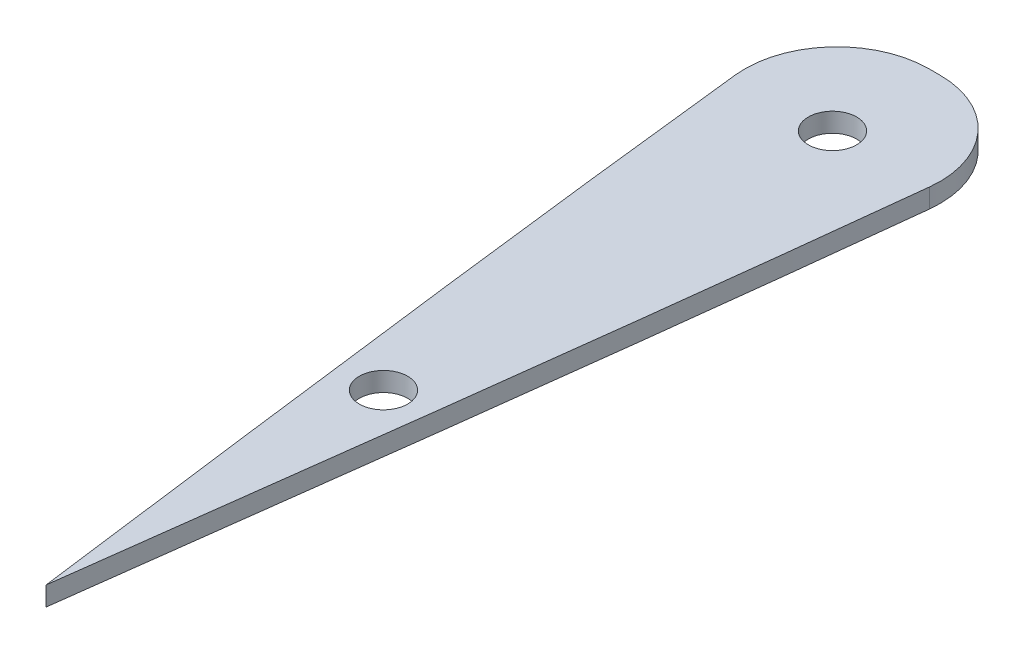
from build123d import *

# Parameters (mm, degrees)
SKETCH1_R               = 1.984375
BOSS_EXTRUDE1_DEPTH     = 169.87266
SKETCH2_W               = 35.763807095
SKETCH2_H               = 22.705005105
CUT_EXTRUDE1_DEPTH      = 23.05812
CUT_EXTRUDE2_START      = -169.87266
SKETCH2_2_W             = 35.763807095
SKETCH2_2_H             = 22.705005105
CUT_EXTRUDE2_DEPTH      = 23.05812
FILLET1_R               = 7.62
CUT_EXTRUDE3_DEPTH      = 198.390942599
CUT_EXTRUDE3_DEPTH_BACK = 198.390942599
SKETCH6_R               = 2
CUT_EXTRUDE4_DEPTH      = 198.390942599
CUT_EXTRUDE4_DEPTH_BACK = 198.390942599
SKETCH7_W               = 96.266326783
SKETCH7_H               = 159.284833333
SKETCH7_H_2             = 9.000326667


with BuildPart() as part:
    # Sketch1 → Boss-Extrude1 (new body)
    with BuildSketch(Plane(origin=(0, 0, 0), x_dir=(1, 0, 0), z_dir=(0, 1, 0))):
        with BuildLine():
            Line((-9.955287346, -3.607451573), (-6.769721368, -3.607451573))
            Line((-6.769721368, -3.607451573), (8.985913589, -3.607451573))
            Line((8.985913589, -3.607451573), (12.171479568, -3.607451573))
            add(Edge.make_bspline(
                [(10.60289965, -20.752451573), (11.099968974, -15.730201571), (11.630563617, -10.016003166), (12.113997871, -4.296816952), (12.171479568, -3.607451573)],
                knots=[0.384969626, 0.384969626, 0.384969626, 0.384969626, 0.458108671, 0.468131593, 0.468131593, 0.468131593, 0.468131593], degree=3))
            add(Edge.make_bspline(
                [(1.108096111, -99.873778356), (4.527344744, -73.531764163), (7.9865599, -47.187219652), (10.60289965, -20.752451573)],
                knots=[0, 0, 0, 0, 0.384969626, 0.384969626, 0.384969626, 0.384969626], degree=3))
            add(Edge.make_bspline(
                [(1.108096111, -99.873778356), (-2.311152522, -73.531764163), (-5.770367679, -47.187219652), (-8.386707429, -20.752451573)],
                knots=[0, 0, 0, 0, 0.384969626, 0.384969626, 0.384969626, 0.384969626], degree=3))
            add(Edge.make_bspline(
                [(-8.386707429, -20.752451573), (-8.883776753, -15.730201571), (-9.414371396, -10.016003166), (-9.89780565, -4.296816952), (-9.955287346, -3.607451573)],
                knots=[0.384969626, 0.384969626, 0.384969626, 0.384969626, 0.458108671, 0.468131593, 0.468131593, 0.468131593, 0.468131593], degree=3))
        make_face()
        with Locations(Location((1.108108569, -11.326456678, 0), (0, 0, 270))):
            Circle(SKETCH1_R, mode=Mode.SUBTRACT)
    extrude(amount=BOSS_EXTRUDE1_DEPTH)

    # Sketch2 → Cut-Extrude1 (cut)
    with BuildSketch(Plane(origin=(0, 169.87266, 0), x_dir=(1, 0, 0), z_dir=(0, 1, 0))):
        with Locations((7.926616202, -14.959954125)):
            Rectangle(SKETCH2_W, SKETCH2_H)
    extrude(amount=-CUT_EXTRUDE1_DEPTH, mode=Mode.SUBTRACT)

    # Sketch2<2> → Cut-Extrude2 (cut)
    with BuildSketch(Plane(origin=(0, 169.87266, 0), x_dir=(1, 0, 0), z_dir=(0, 1, 0)).offset(CUT_EXTRUDE2_START)):
        with Locations((7.926616202, -14.959954125)):
            Rectangle(SKETCH2_2_W, SKETCH2_2_H)
    extrude(amount=CUT_EXTRUDE2_DEPTH, mode=Mode.SUBTRACT)

    # Fillet1
    fillet1_edges = [part.edges().sort_by_distance(p)[0] for p in [
        (-7.824155374, 11.52906, 26.312456678),
        (10.040347595, 11.52906, 26.312456678),
        (-9.955287346, 84.93633, 3.607451573),
        (12.171479568, 84.93633, 3.607451573),
        (-7.824155374, 158.3436, 26.312456678),
        (10.040347595, 158.3436, 26.312456678),
    ]]
    fillet(fillet1_edges, radius=FILLET1_R)

    # Sketch6 → Cut-Extrude3 (cut, two sides: drawn at the far end of the back side and taken through both)
    with BuildSketch(Plane.XZ.offset(-CUT_EXTRUDE3_DEPTH_BACK)):
        with Locations(Location((1.108096111, 71.933778356, 0), (0, 0, 270))):
            Circle(SKETCH6_R)
        with Locations(Location((1.108096111, 34.760552137, 0), (0, 0, 270))):
            Circle(SKETCH6_R)
    extrude(amount=CUT_EXTRUDE3_DEPTH + CUT_EXTRUDE3_DEPTH_BACK, mode=Mode.SUBTRACT)

    # Sketch7 → Cut-Extrude4 (cut, two sides: drawn at the far end of the back side and taken through both)
    with BuildSketch(Plane(origin=(0, 0, 0), x_dir=(0, 0, -1), z_dir=(1, 0, 0)).offset(-CUT_EXTRUDE4_DEPTH_BACK)):
        with Locations((-51.740614965, 79.642416667)):
            Rectangle(SKETCH7_W, SKETCH7_H)
        with Locations((-51.740614965, 165.372496667)):
            Rectangle(SKETCH7_W, SKETCH7_H_2)
    extrude(amount=CUT_EXTRUDE4_DEPTH + CUT_EXTRUDE4_DEPTH_BACK, mode=Mode.SUBTRACT)


solid = part.part
